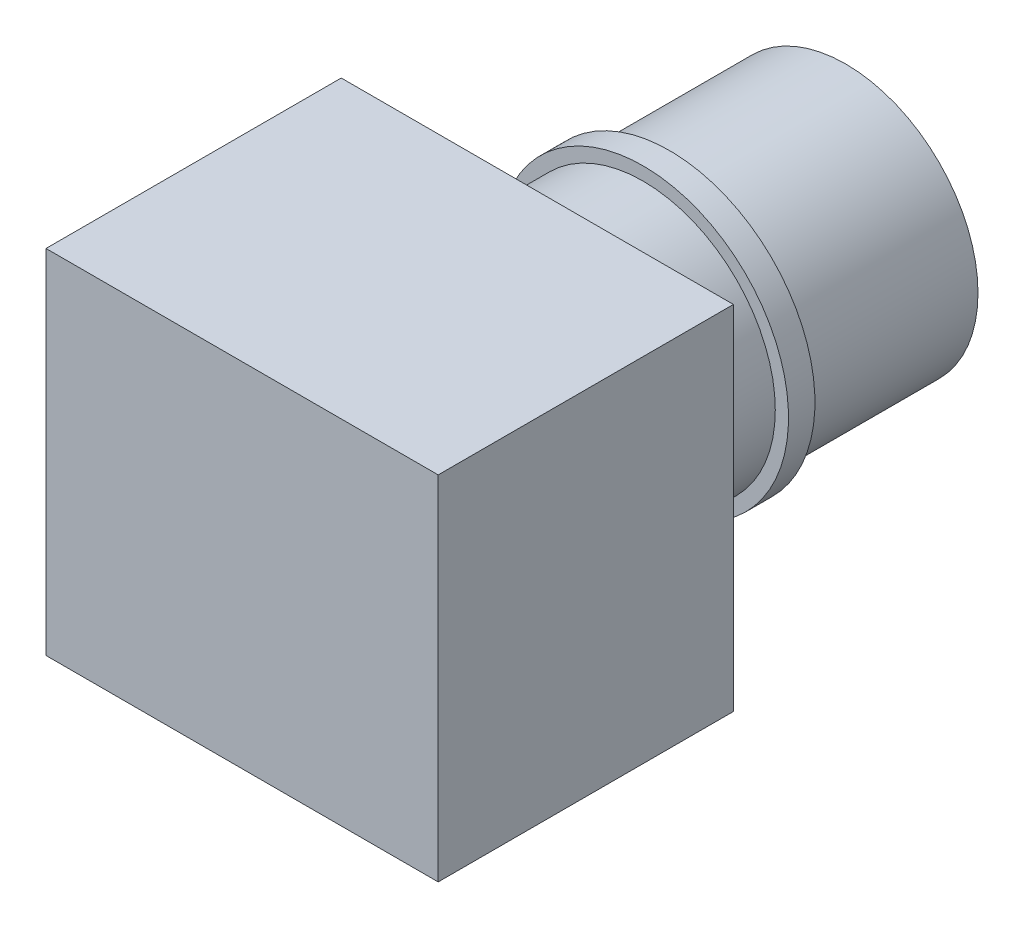
from build123d import *

# Parameters (mm, degrees)
SKETCH_1_W      = 44.5
SKETCH_1_H      = 33.5
EXTRUDE_1_DEPTH = 40
SKETCH_2_R      = 15
EXTRUDE_2_DEPTH = 12
SKETCH_3_R      = 16.5
EXTRUDE_3_DEPTH = 3
SKETCH_4_R      = 15
EXTRUDE_4_DEPTH = 20


with BuildPart() as part:
    # 草图1 → 凸台-拉伸1 (new body)
    with BuildSketch(Plane(origin=(0, 0, 0), x_dir=(1, 0, 0), z_dir=(0, 1, 0))):
        Rectangle(SKETCH_1_W, SKETCH_1_H)
    extrude(amount=EXTRUDE_1_DEPTH)

    # 草图2 → 凸台-拉伸2 (add)
    with BuildSketch(Plane(origin=(0, 0, -16.75), x_dir=(-1, 0, 0), z_dir=(0, 0, -1))):
        with Locations((0, 20)):
            Circle(SKETCH_2_R)
    extrude(amount=EXTRUDE_2_DEPTH)

    # 草图3 → 凸台-拉伸3 (add)
    with BuildSketch(Plane(origin=(0, 0, -28.75), x_dir=(-1, 0, 0), z_dir=(0, 0, -1))):
        with Locations((0, 20)):
            Circle(SKETCH_3_R)
    extrude(amount=EXTRUDE_3_DEPTH)

    # 草图4 → 凸台-拉伸4 (add)
    with BuildSketch(Plane(origin=(0, 0, -31.75), x_dir=(-1, 0, 0), z_dir=(0, 0, -1))):
        with Locations((0, 20)):
            Circle(SKETCH_4_R)
    extrude(amount=EXTRUDE_4_DEPTH)


solid = part.part
